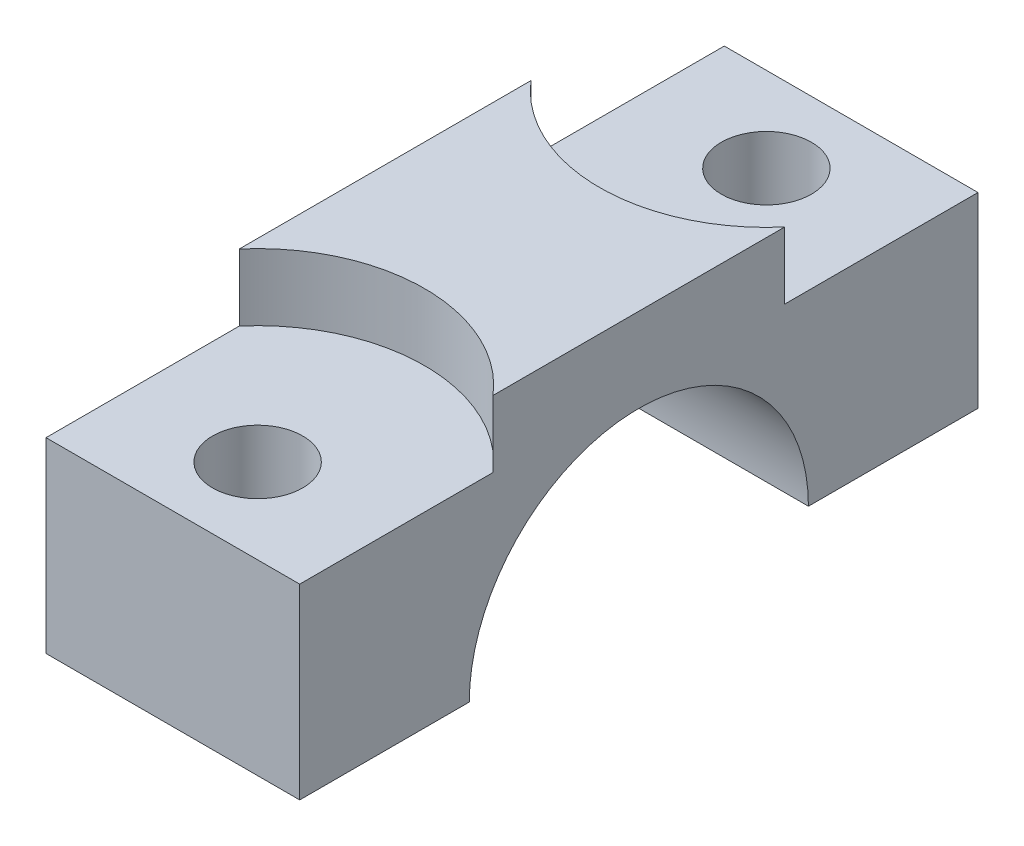
from build123d import *

# Parameters (mm, degrees)
BOSS_EXTRUDE1_DEPTH                           = 9.5
CBORE_FOR_M12_HEX_HEAD_CAP_SCREW1_D           = 6.75
CBORE_FOR_M12_HEX_HEAD_CAP_SCREW1_DEPTH       = 326.39
CBORE_FOR_M12_HEX_HEAD_CAP_SCREW1_CBORE_D     = 25
CBORE_FOR_M12_HEX_HEAD_CAP_SCREW1_CBORE_DEPTH = 5


with BuildPart() as part:
    # Sketch1 → Boss-Extrude1 (new, symmetric)
    with BuildSketch(Plane(origin=(0, 0, 0), x_dir=(0, 0, -1), z_dir=(1, 0, 0))):
        with BuildLine():
            Line((12.7, 0), (25.4, 0))
            Line((25.4, 0), (25.4, 19))
            Line((25.4, 19), (-25.4, 19))
            Line((-25.4, 19), (-25.4, 0))
            Line((-25.4, 0), (-12.7, 0))
            ThreePointArc((-12.7, 0), (0, 12.7), (12.7, 0))
        make_face()
    extrude(amount=BOSS_EXTRUDE1_DEPTH, both=True)

    # CBORE for M12 Hex Head Cap Screw1
    with Locations(Plane(origin=(0, 19, 0), x_dir=(1, 0, 0), z_dir=(0, 1, 0))):
        with Locations((0, 19.05), (0, -19.05)):
            CounterBoreHole(CBORE_FOR_M12_HEX_HEAD_CAP_SCREW1_D / 2, CBORE_FOR_M12_HEX_HEAD_CAP_SCREW1_CBORE_D / 2, CBORE_FOR_M12_HEX_HEAD_CAP_SCREW1_CBORE_DEPTH, depth=CBORE_FOR_M12_HEX_HEAD_CAP_SCREW1_DEPTH)


solid = part.part
